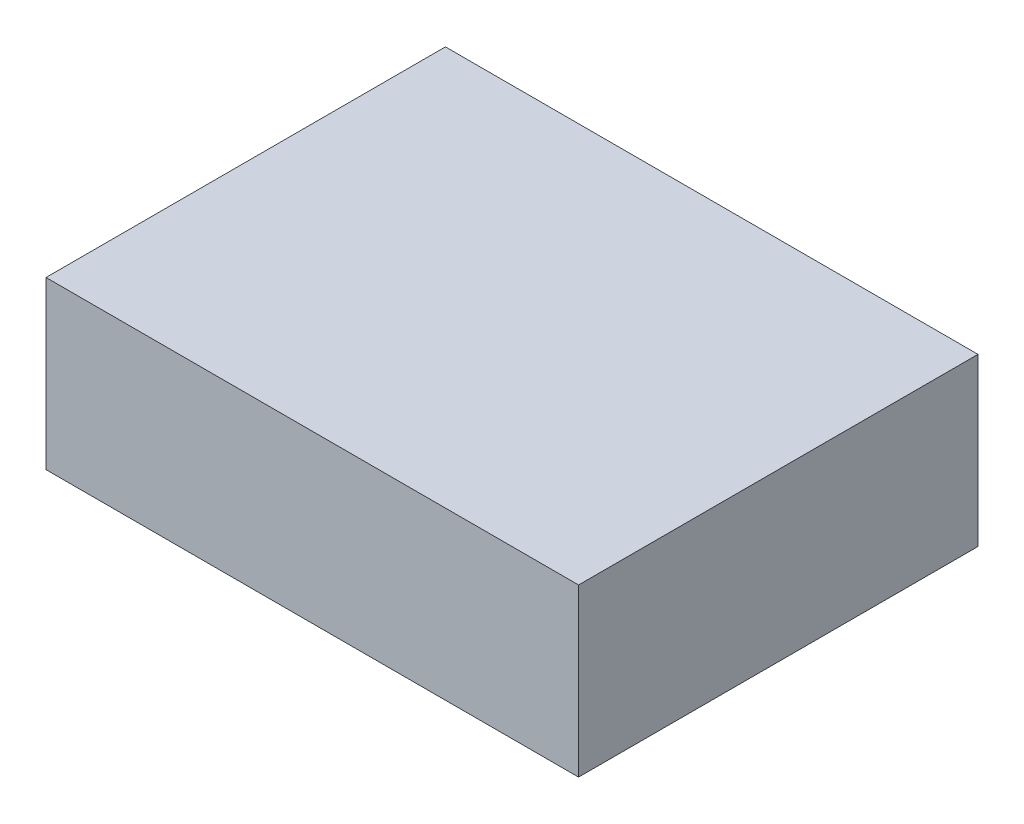
from build123d import *

# Parameters (mm, degrees)
SKETCH2_W           = 320
SKETCH2_H           = 240
BOSS_EXTRUDE1_DEPTH = 100


with BuildPart() as part:
    # Sketch2 → Boss-Extrude1 (new body)
    with BuildSketch(Plane(origin=(0, 0, 0), x_dir=(1, 0, 0), z_dir=(0, 1, 0))):
        Rectangle(SKETCH2_W, SKETCH2_H)
    extrude(amount=BOSS_EXTRUDE1_DEPTH)


solid = part.part
